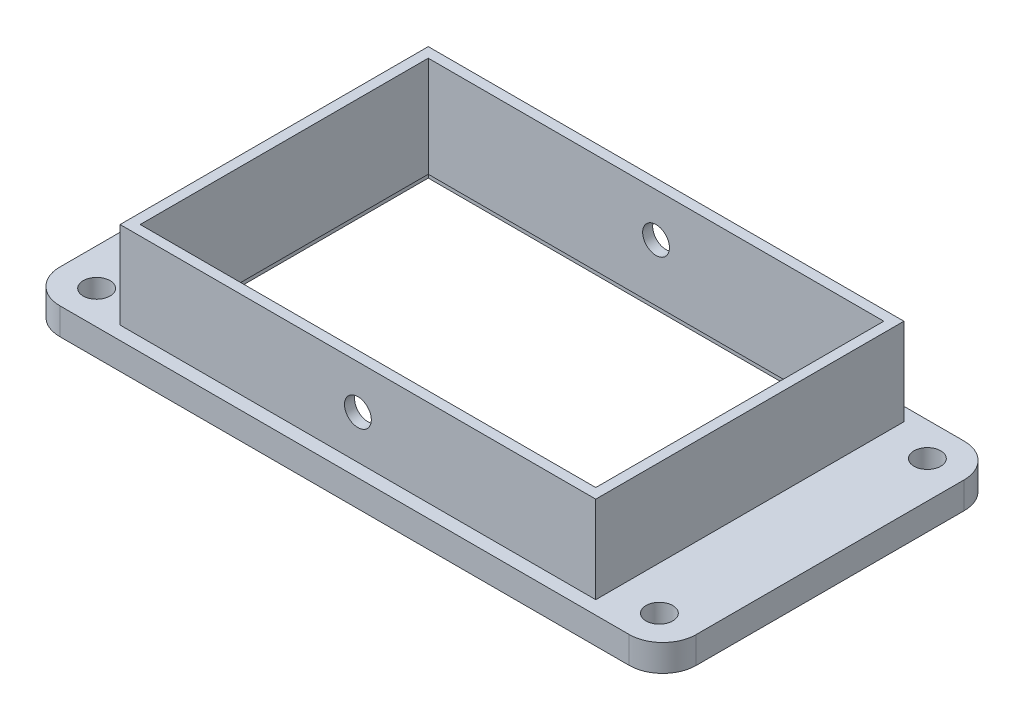
from build123d import *

# Parameters (mm, degrees)
SKETCH_1_W          = 71
SKETCH_1_H          = 46
SKETCH_1_W_2        = 68
SKETCH_1_H_2        = 43
EXTRUDE_1_DEPTH     = 15
SKETCH_2_R          = 2
SKETCH_2_W          = 71
SKETCH_2_H          = 46
EXTRUDE_2_DEPTH     = 2
EXTRUDE_START       = 2
SKETCH_2_2_R        = 2
SKETCH_2_2_W        = 71
SKETCH_2_2_H        = 46
EXTRUDE_3_DEPTH     = 2
SKETCH_3_R          = 2
CUT_EXTRUDE_1_DEPTH = 96.766643462


with BuildPart() as part:
    # 草图1 → 凸台-拉伸1 (new body)
    with BuildSketch(Plane(origin=(0, 0, 0), x_dir=(1, 0, 0), z_dir=(0, 1, 0))):
        with Locations((34, 21.5)):
            Rectangle(SKETCH_1_W, SKETCH_1_H)
        with Locations((34, 21.5)):
            Rectangle(SKETCH_1_W_2, SKETCH_1_H_2, mode=Mode.SUBTRACT)
    extrude(amount=EXTRUDE_1_DEPTH)

    # 草图2 → 凸台-拉伸2 (add)
    with BuildSketch(Plane.XZ):
        with BuildLine():
            Line((76.5, -46.5), (-8.5, -46.5))
            ThreePointArc((-8.5, -46.5), (-12.035533906, -45.035533906), (-13.5, -41.5))
            Line((-13.5, -41.5), (-13.5, -1.5))
            ThreePointArc((-13.5, -1.5), (-12.035533906, 2.035533906), (-8.5, 3.5))
            Line((-8.5, 3.5), (76.5, 3.5))
            ThreePointArc((76.5, 3.5), (80.035533906, 2.035533906), (81.5, -1.5))
            Line((81.5, -1.5), (81.5, -41.5))
            ThreePointArc((81.5, -41.5), (80.035533906, -45.035533906), (76.5, -46.5))
        make_face()
        with Locations((76, -41.5)):
            Circle(SKETCH_2_R, mode=Mode.SUBTRACT)
        with Locations((76, -1.5)):
            Circle(SKETCH_2_R, mode=Mode.SUBTRACT)
        with Locations((-8, -1.5)):
            Circle(SKETCH_2_R, mode=Mode.SUBTRACT)
        with Locations((-8, -41.5)):
            Circle(SKETCH_2_R, mode=Mode.SUBTRACT)
        with Locations((34, -21.5)):
            Rectangle(SKETCH_2_W, SKETCH_2_H, mode=Mode.SUBTRACT)
    extrude(amount=-EXTRUDE_2_DEPTH)

    # 草图2<2> → 凸台-拉伸3 (add)
    with BuildSketch(Plane.XZ.offset(EXTRUDE_START)):
        with BuildLine():
            Line((76.5, -46.5), (-8.5, -46.5))
            ThreePointArc((-8.5, -46.5), (-12.035533906, -45.035533906), (-13.5, -41.5))
            Line((-13.5, -41.5), (-13.5, -1.5))
            ThreePointArc((-13.5, -1.5), (-12.035533906, 2.035533906), (-8.5, 3.5))
            Line((-8.5, 3.5), (76.5, 3.5))
            ThreePointArc((76.5, 3.5), (80.035533906, 2.035533906), (81.5, -1.5))
            Line((81.5, -1.5), (81.5, -41.5))
            ThreePointArc((81.5, -41.5), (80.035533906, -45.035533906), (76.5, -46.5))
        make_face()
        with Locations((76, -41.5)):
            Circle(SKETCH_2_2_R, mode=Mode.SUBTRACT)
        with Locations((76, -1.5)):
            Circle(SKETCH_2_2_R, mode=Mode.SUBTRACT)
        with Locations((-8, -1.5)):
            Circle(SKETCH_2_2_R, mode=Mode.SUBTRACT)
        with Locations((-8, -41.5)):
            Circle(SKETCH_2_2_R, mode=Mode.SUBTRACT)
        with Locations((34, -21.5)):
            Rectangle(SKETCH_2_2_W, SKETCH_2_2_H, mode=Mode.SUBTRACT)
    extrude(amount=-EXTRUDE_3_DEPTH)

    # 草图3 → 切除-拉伸1 (cut, through all)
    with BuildSketch(Plane.XY.offset(1.5)):
        with Locations((34, 8.5)):
            Circle(SKETCH_3_R)
    extrude(amount=-CUT_EXTRUDE_1_DEPTH, mode=Mode.SUBTRACT)


solid = part.part
